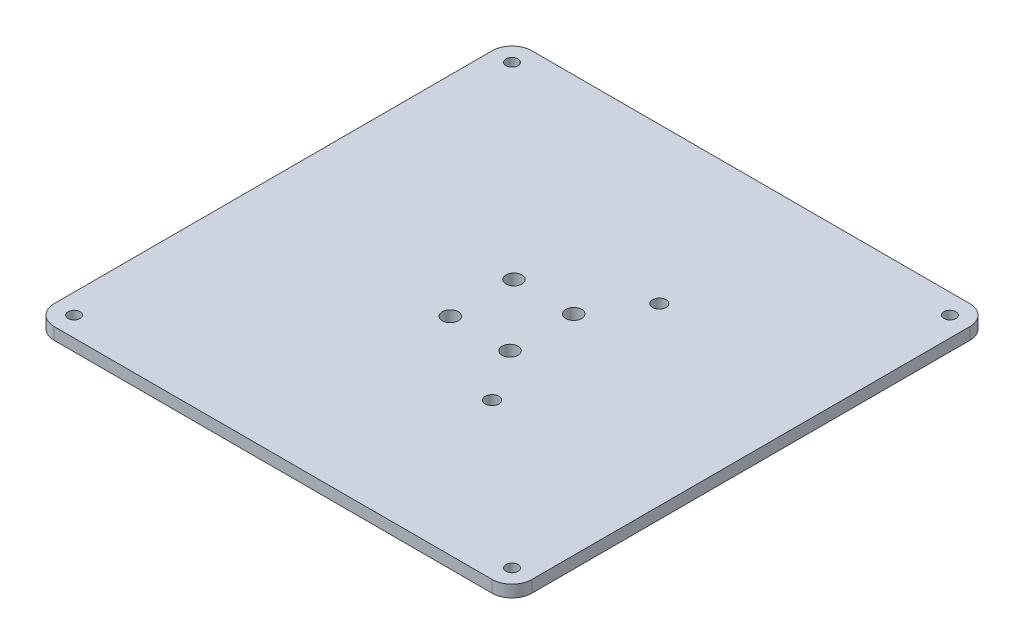
from build123d import *

# Parameters (mm, degrees)
SKETCH1_W                                  = 120
SKETCH1_H                                  = 120
SKETCH1_R                                  = 2
BOSS_EXTRUDE1_DEPTH                        = 3
FILLET1_R                                  = 5
SKETCH2_R                                  = 1.5
CUT_EXTRUDE1_DEPTH                         = 85.905830189
MIRROR3_AT_THE_SECOND_PLANE_COPY_1_SKETC_R = 1.5
MIRROR3_AT_THE_SECOND_PLANE_COPY_1_DEPTH   = 85.905830189
SKETCH3_R                                  = 1.7
CUT_EXTRUDE2_DEPTH                         = 85.905830189


with BuildPart() as part:
    # Sketch1 → Boss-Extrude1 (new body)
    with BuildSketch(Plane(origin=(0, 0, 0), x_dir=(1, 0, 0), z_dir=(0, 1, 0))):
        Rectangle(SKETCH1_W, SKETCH1_H)
        with Locations(Location((-7.5, -8, 0), (0, 0, 270))):
            Circle(SKETCH1_R, mode=Mode.SUBTRACT)
        with Locations(Location((7.5, 8, 0), (0, 0, 270))):
            Circle(SKETCH1_R, mode=Mode.SUBTRACT)
        with Locations(Location((7.5, -8, 0), (0, 0, 270))):
            Circle(SKETCH1_R, mode=Mode.SUBTRACT)
        with Locations(Location((-7.5, 8, 0), (0, 0, 270))):
            Circle(SKETCH1_R, mode=Mode.SUBTRACT)
    extrude(amount=BOSS_EXTRUDE1_DEPTH)

    # Fillet1
    fillet1_edges = [part.edges().sort_by_distance(p)[0] for p in [
        (60, 1.5, 60),
        (-60, 1.5, 60),
        (-60, 1.5, -60),
        (60, 1.5, -60),
    ]]
    fillet(fillet1_edges, radius=FILLET1_R)

    # Sketch2 → Cut-Extrude1 (cut, through all)
    with BuildSketch(Plane(origin=(0, 3, 0), x_dir=(1, 0, 0), z_dir=(0, 1, 0))):
        with Locations(Location((-55, 55, 0), (0, 0, 270))):
            Circle(SKETCH2_R)
    cut_extrude1 = extrude(amount=-CUT_EXTRUDE1_DEPTH, mode=Mode.SUBTRACT)

    # Mirror3: Cut-Extrude1 across plane
    add(cut_extrude1.mirror(Plane.XY), mode=Mode.SUBTRACT)

    # Mirror3 at the second plane: Cut-Extrude1 across plane
    add(cut_extrude1.mirror(Plane(origin=(0, 0, 0), x_dir=(0, 0, 1), z_dir=(1, 0, 0))), mode=Mode.SUBTRACT)

    # Mirror3 at the second plane copy 1 sketc → Mirror3 at the second plane copy 1 (cut, through all)
    with BuildSketch(Plane(origin=(0, 3, 0), x_dir=(-1, 0, 0), z_dir=(0, 1, 0))):
        with Locations(Location((-55, 55, 0), (0, 0, 270))):
            Circle(MIRROR3_AT_THE_SECOND_PLANE_COPY_1_SKETC_R)
    extrude(amount=-MIRROR3_AT_THE_SECOND_PLANE_COPY_1_DEPTH, mode=Mode.SUBTRACT)

    # Sketch3 → Cut-Extrude2 (cut, through all)
    with BuildSketch(Plane(origin=(0, 3, 0), x_dir=(1, 0, 0), z_dir=(0, 1, 0))):
        with Locations(Location((16, 21, 0), (0, 0, 270))):
            Circle(SKETCH3_R)
        with Locations(Location((16, -21, 0), (0, 0, 270))):
            Circle(SKETCH3_R)
    extrude(amount=-CUT_EXTRUDE2_DEPTH, mode=Mode.SUBTRACT)


solid = part.part
